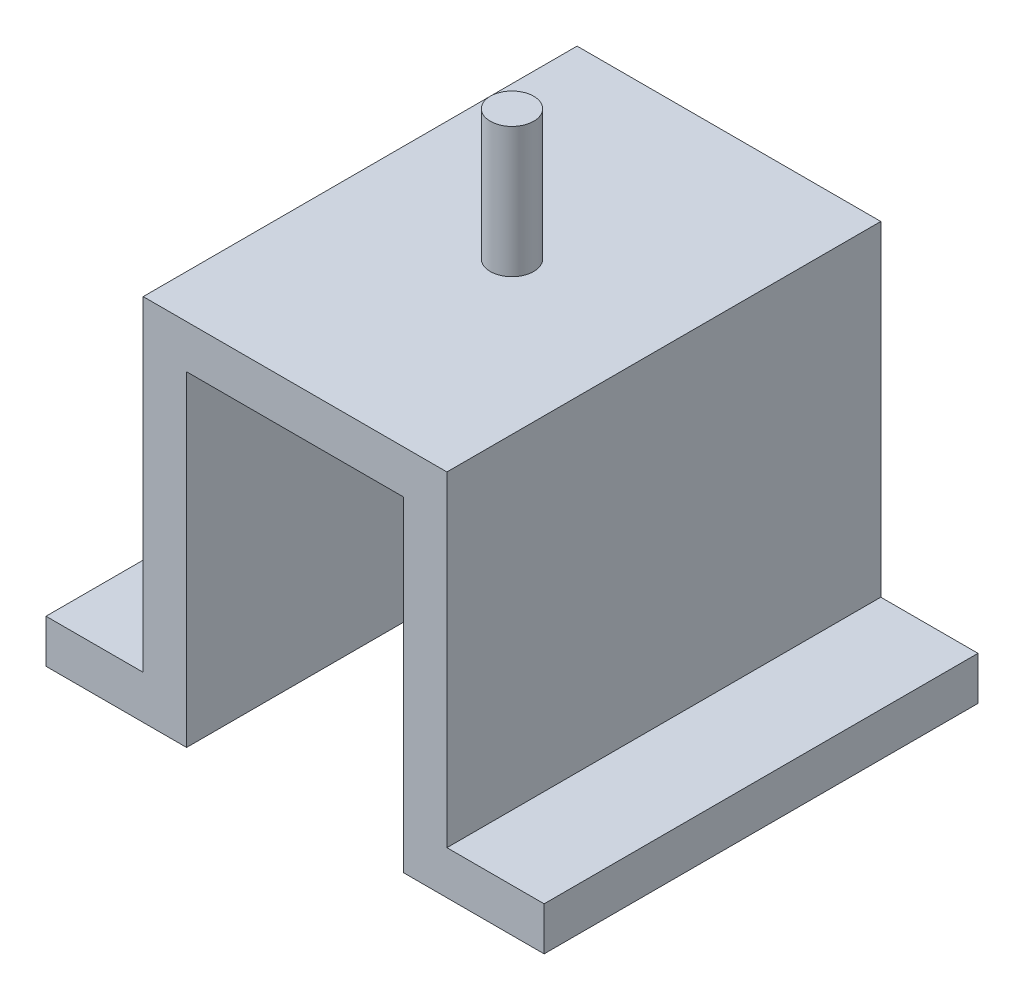
from build123d import *

# Parameters (mm, degrees)
BOSS_EXTRUDE1_DEPTH   = 100
BOSS_EXTRUDE1_2_DEPTH = 100
SKETCH2_W             = 70
SKETCH2_H             = 100
BOSS_EXTRUDE2_DEPTH   = 10
SKETCH3_R             = 5
BOSS_EXTRUDE3_DEPTH   = 30


with BuildPart() as part:
    # Sketch1 → Boss-Extrude1 (new body)
    with BuildSketch(Plane.XY):
        Polygon((-57.404010399, -45.485546177), (-25, -45.485546177), (-25, 29.514453823), (-35, 29.514453823), (-35, -35.485546177), (-57.404010399, -35.485546177), align=None)
    extrude(amount=BOSS_EXTRUDE1_DEPTH)



with BuildPart() as body_2:
    # Sketch1 → Boss-Extrude1 2 (new body)
    with BuildSketch(Plane.XY):
        Polygon((25, 29.514453823), (35, 29.514453823), (35, -35.485546177), (57.404010399, -35.485546177), (57.404010399, -45.485546177), (25, -45.485546177), align=None)
    extrude(amount=BOSS_EXTRUDE1_2_DEPTH)


with BuildPart() as part_1:
    add(part.part)

    add(body_2.part)  # Boss-Extrude2 merges body 2
    # Sketch2 → Boss-Extrude2 (add)
    with BuildSketch(Plane(origin=(0, 29.514453823, 0), x_dir=(1, 0, 0), z_dir=(0, 1, 0))):
        with Locations((0, -50)):
            Rectangle(SKETCH2_W, SKETCH2_H)
    extrude(amount=BOSS_EXTRUDE2_DEPTH)

    # Sketch3 → Boss-Extrude3 (add)
    with BuildSketch(Plane(origin=(0, 39.514453823, 0), x_dir=(1, 0, 0), z_dir=(0, 1, 0))):
        with Locations(Location((0, -50, 0), (0, 0, 180))):
            Circle(SKETCH3_R)
    extrude(amount=BOSS_EXTRUDE3_DEPTH)


solid = part_1.part
